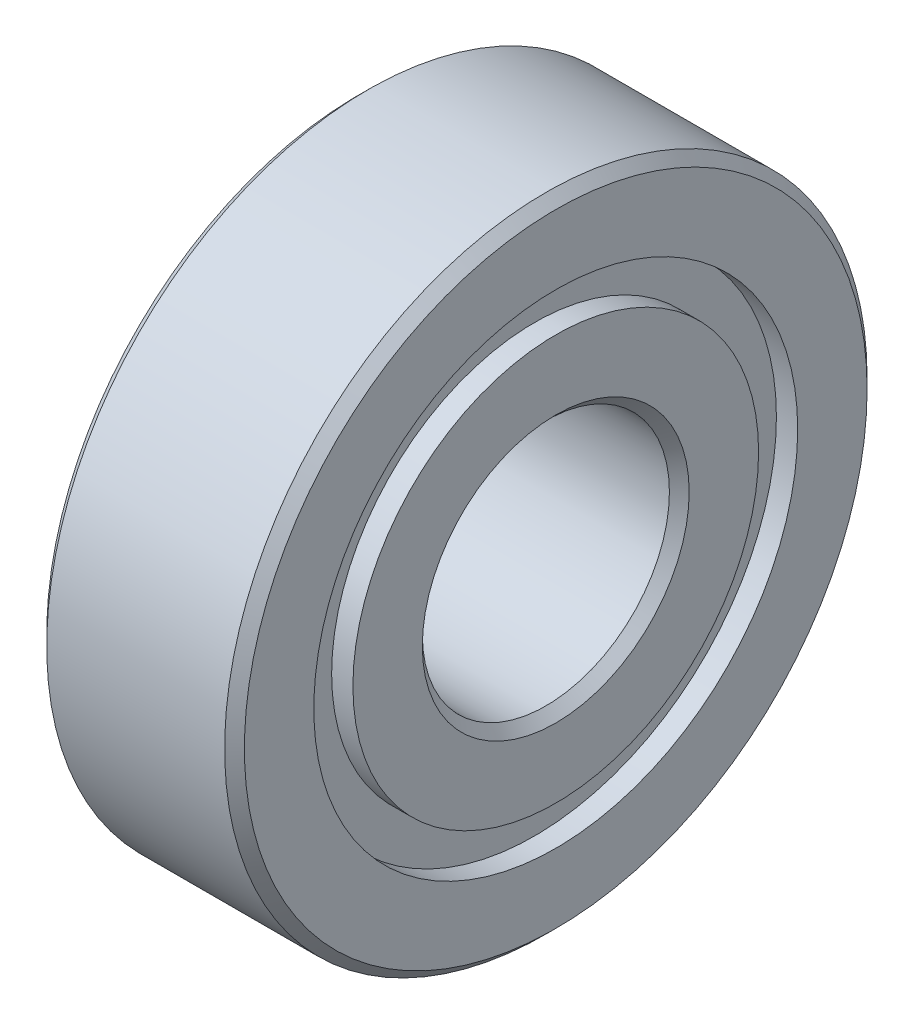
from build123d import *


with BuildPart() as part:
    # Sketch1 → Revolve1 (revolve)
    with BuildSketch(Plane.XY, mode=Mode.PRIVATE) as revolve1_sk:
        Polygon((4, 12.6), (3.6, 13), (-3.6, 13), (-4, 12.6), (-4, 9.791208791), (-3.13888889, 9.791208791), (-3.13888889, 8.208791209), (-4, 8.208791209), (-4, 5.4), (-3.6, 5), (3.6, 5), (4, 5.4), (4, 8.208791209), (3.13888889, 8.208791209), (3.13888889, 9.791208791), (4, 9.791208791), align=None)
    revolve(revolve1_sk.sketch.rotate(Axis((-4, 0, 0), (1, 0, 0)), 270), axis=Axis((-4, 0, 0), (1, 0, 0)))


solid = part.part
